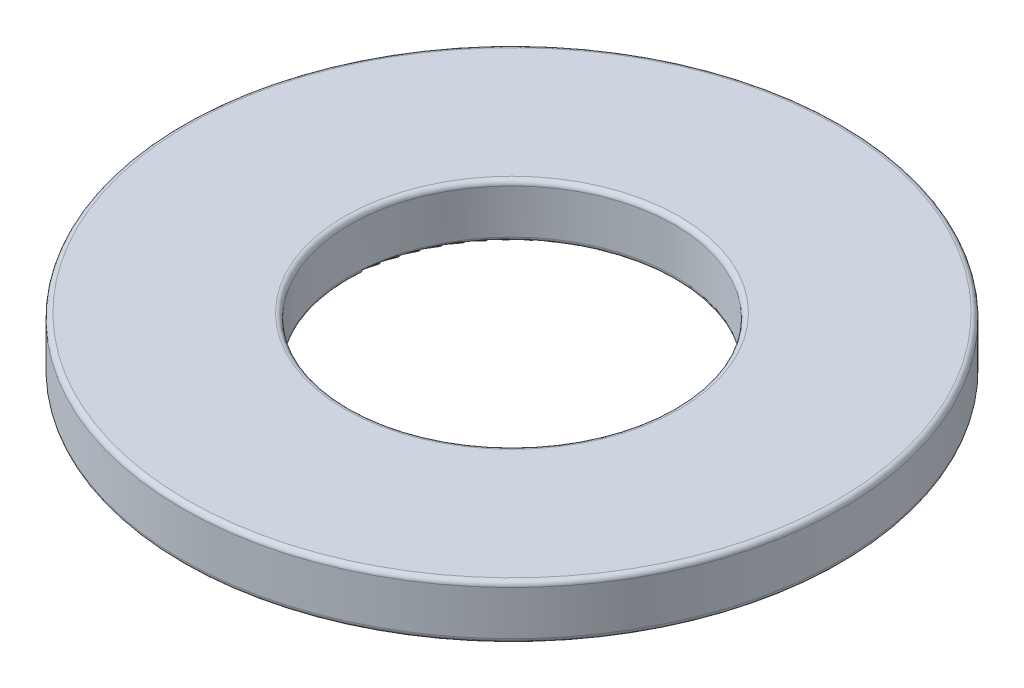
from build123d import *

# Parameters (mm, degrees)
SKETCH1_W = 1.7
SKETCH1_H = 0.55
FILLET1_R = 0.05


with BuildPart() as part:
    # Sketch1 → Revolve1 (revolve)
    with BuildSketch(Plane.XY, mode=Mode.PRIVATE) as revolve1_sk:
        with Locations((2.5, 0.275)):
            Rectangle(SKETCH1_W, SKETCH1_H)
    revolve(revolve1_sk.sketch.rotate(Axis((0, 0, 0), (0, 1, 0)), 90), axis=Axis((0, 0, 0), (0, 1, 0)))

    # Fillet1
    fillet1_edges = [part.edges().sort_by_distance(p)[0] for p in [
        (0, 0.55, 1.65),
        (0, 0.55, 3.35),
        (0, 0, 3.35),
        (0, 0, 1.65),
    ]]
    fillet(fillet1_edges, radius=FILLET1_R)


solid = part.part
